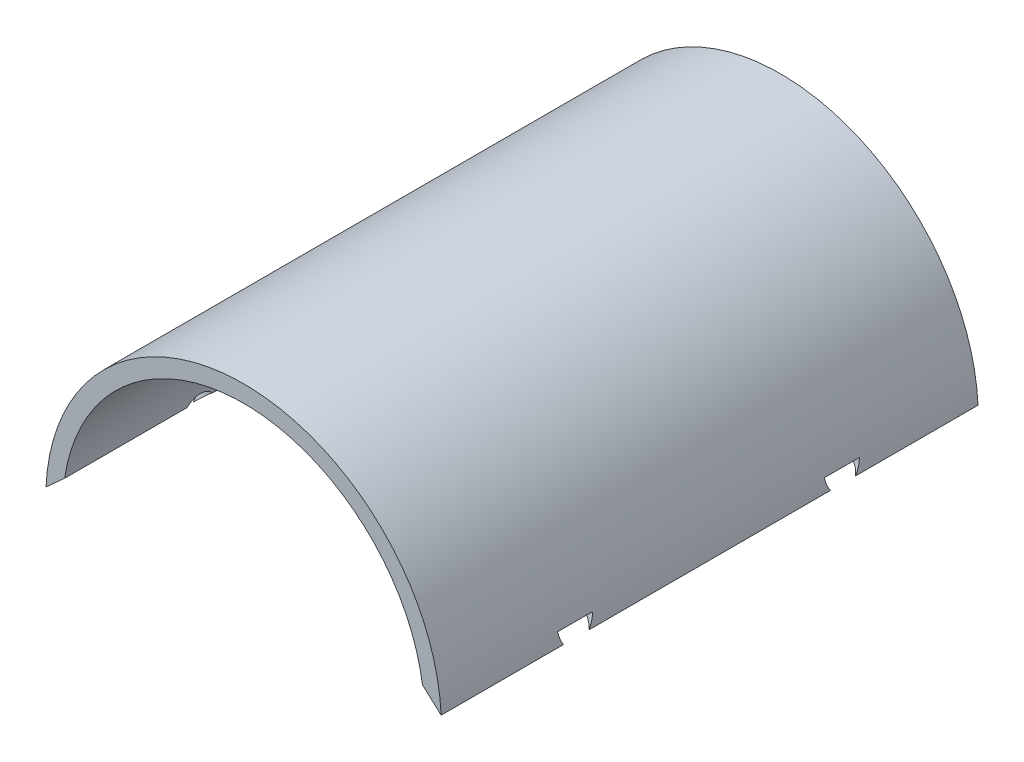
from build123d import *

# Parameters (mm, degrees)
BOSS_EXTRUDE1_DEPTH = 120.65
SKETCH2_R           = 4
CUT_EXTRUDE1_DEPTH  = 2
SKETCH3_R           = 4
CUT_EXTRUDE2_DEPTH  = 2


with BuildPart() as part:
    # Sketch1 → Boss-Extrude1 (new body)
    with BuildSketch(Plane.XY):
        with BuildLine():
            Line((-40.203883769, 5.937788296), (-44.399042974, 2.127788296))
            ThreePointArc((-44.399042974, 2.127788296), (0, 44.45), (44.399042974, 2.127788296))
            Line((44.399042974, 2.127788296), (40.203883769, 5.937788296))
            ThreePointArc((40.203883769, 5.937788296), (0, 40.64), (-40.203883769, 5.937788296))
        make_face()
    extrude(amount=BOSS_EXTRUDE1_DEPTH)

    # Sketch2 → Cut-Extrude1 (cut)
    with BuildSketch(Plane(origin=(-21.127225221, 23.263011377, 0), x_dir=(0.7402720771062566, 0.6723074087475077, 0), z_dir=(0.6723074087475077, -0.7402720771062566, 0))):
        with Locations((-28.603318705, 90.349309036)):
            Circle(SKETCH2_R)
        with Locations((-28.603318705, 30.300690964)):
            Circle(SKETCH2_R)
    extrude(amount=-CUT_EXTRUDE1_DEPTH, mode=Mode.SUBTRACT)

    # Sketch3 → Cut-Extrude2 (cut)
    with BuildSketch(Plane(origin=(21.127225221, 23.263011377, 0), x_dir=(0.7402720771062566, -0.6723074087475077, 0), z_dir=(-0.6723074087475077, -0.7402720771062566, 0))):
        with Locations((28.603318705, 90.297)):
            Circle(SKETCH3_R)
        with Locations((28.603318705, 30.353)):
            Circle(SKETCH3_R)
    extrude(amount=-CUT_EXTRUDE2_DEPTH, mode=Mode.SUBTRACT)


solid = part.part
